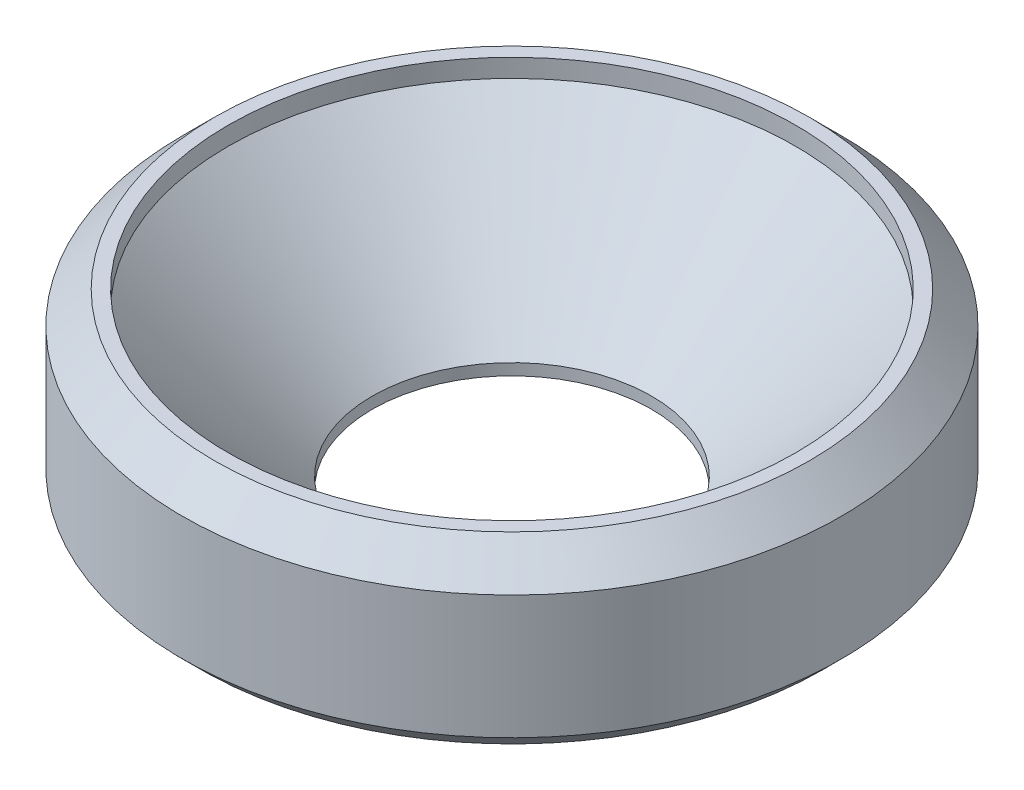
from build123d import *


with BuildPart() as part:
    # Sketch1 → Revolve1 (revolve)
    with BuildSketch(Plane.XY):
        Polygon((-6.8, 0), (-3.05, 0), (-3.05, 0.25), (-6.2, 3.4), (-6.2, 3.8), (-6.5, 3.8), (-7.2, 3.1), (-7.2, 0.4), align=None)
    revolve(axis=Axis((0, 35.705330925, 0), (0, -1, 0)))


solid = part.part
